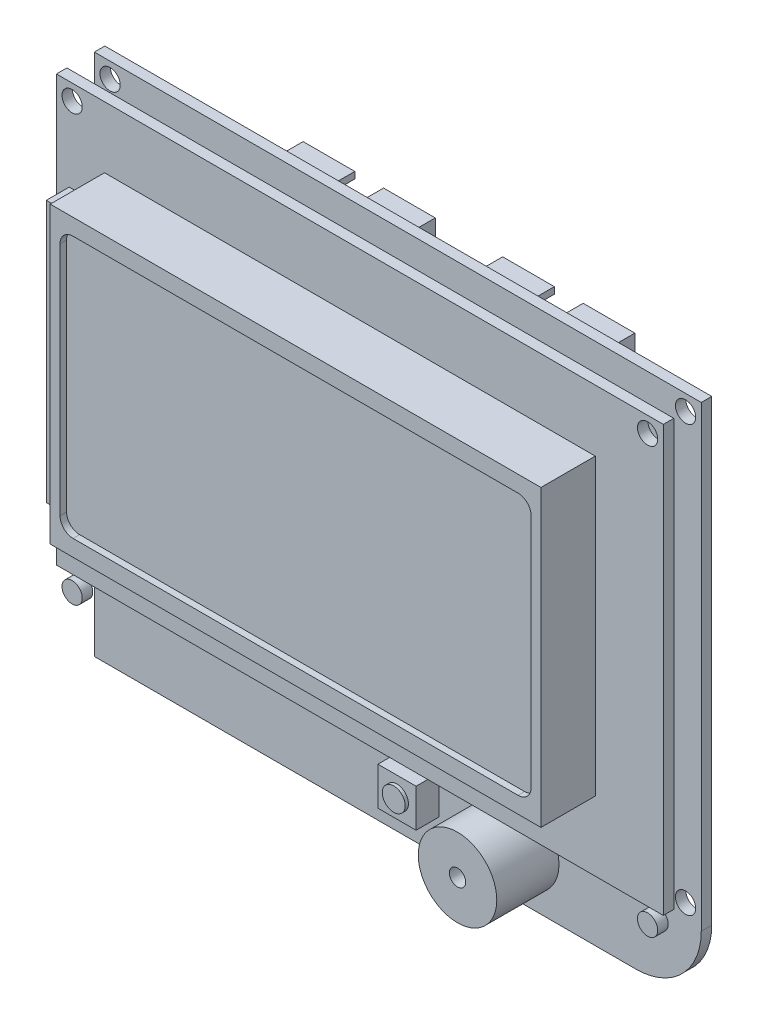
from build123d import *

# Parameters (mm, degrees)
SKETCH1_W                             = 92.75
SKETCH1_H                             = 80
SKETCH1_R                             = 1.55
BOSS_EXTRUDE1_FIRST_PCB_DEPTH         = 1.6
SKETCH2_R                             = 6
BOSS_EXTRUDE2_SPEAKER_DEPTH           = 9.5
SKETCH15_R                            = 1.25
CUT_EXTRUDE1_SPEAKER_HOLE_DEPTH       = 5
SKETCH4_W                             = 5.83
SKETCH4_H                             = 5.83
BOSS_EXTRUDE4_RESET_SWITCH_DEPTH      = 3.5
SKETCH5_R                             = 1.75
BOSS_EXTRUDE5_RESET_BUTTON_DEPTH      = 0.5
SKETCH19_W                            = 50
SKETCH19_H                            = 2.5
BOSS_EXTRUDE10_CONNECTOR_DEPTH        = 4.2
SKETCH11_R                            = 1.55
SKETCH11_W                            = 92.75
SKETCH11_H                            = 65
BOSS_EXTRUDE11_UPPER_PCB_DEPTH        = 1.6
SKETCH12_W                            = 75
SKETCH12_H                            = 45
BOSS_EXTRUDE12_LCD_DEPTH              = 8.3
SKETCH24_W                            = 5.4
SKETCH24_H                            = 40
BOSS_EXTRUDE13_LCD_BUMPOUT_DEPTH      = 3.5
CUT_EXTRUDE2_SCREEN_RECESS_DEPTH      = 1
SKETCH21_W                            = 20.2
SKETCH21_H                            = 8.85
SKETCH21_W_2                          = 18.2
SKETCH21_H_2                          = 6.85
BOSS_EXTRUDE14_CONNECTORS_DEPTH       = 9
SKETCH22_W                            = 18.2
SKETCH22_H                            = 6.85
BOSS_EXTRUDE15_CONNECTOR_RECESS_DEPTH = 2.55
SKETCH23_W                            = 4.4
SKETCH23_H                            = 1
CUT_EXTRUDE3_CONNECTOR_NOTCH_DEPTH    = 6.45
FILLET1_R                             = 10


with BuildPart() as part:
    # Sketch1 → Boss-Extrude1 - First PCB (new body)
    with BuildSketch(Plane.XY):
        Rectangle(SKETCH1_W, SKETCH1_H)
        with Locations((-43.975, 37.6)):
            Circle(SKETCH1_R, mode=Mode.SUBTRACT)
        with Locations(Location((43.975, 37.6, 0), (0, 0, 180))):
            Circle(SKETCH1_R, mode=Mode.SUBTRACT)
        with Locations((43.975, -27.4)):
            Circle(SKETCH1_R, mode=Mode.SUBTRACT)
        with Locations(Location((-43.975, -27.4, 0), (0, 0, 180))):
            Circle(SKETCH1_R, mode=Mode.SUBTRACT)
    extrude(amount=BOSS_EXTRUDE1_FIRST_PCB_DEPTH)

    # Sketch2 → Boss-Extrude2 - Speaker (add)
    with BuildSketch(Plane.XY.offset(1.6)):
        with Locations(Location((18.625, -32, 0), (0, 0, 180))):
            Circle(SKETCH2_R)
    extrude(amount=BOSS_EXTRUDE2_SPEAKER_DEPTH)

    # Sketch15 → Cut-Extrude1 - Speaker Hole (cut)
    with BuildSketch(Plane.XY.offset(11.1)):
        with Locations((18.625, -32)):
            Circle(SKETCH15_R)
    extrude(amount=-CUT_EXTRUDE1_SPEAKER_HOLE_DEPTH, mode=Mode.SUBTRACT)

    # Sketch4 → Boss-Extrude4 - Reset Switch (add)
    with BuildSketch(Plane(origin=(0, 0, 1.6), x_dir=(-1, 0, 0), z_dir=(0, 0, 1))):
        with Locations((-3.375, 32)):
            Rectangle(SKETCH4_W, SKETCH4_H)
    extrude(amount=BOSS_EXTRUDE4_RESET_SWITCH_DEPTH)

    # Sketch5 → Boss-Extrude5 - Reset Button (add)
    with BuildSketch(Plane(origin=(0, 0, 5.1), x_dir=(-1, 0, 0), z_dir=(0, 0, 1))):
        with Locations(Location((-3.375, 32, 0), (0, 0, 180))):
            Circle(SKETCH5_R)
    extrude(amount=BOSS_EXTRUDE5_RESET_BUTTON_DEPTH)

    # Sketch19 → Boss-Extrude10 - Connector (add)
    with BuildSketch(Plane.XY.offset(1.6)):
        with Locations((-8.375, -20.75)):
            Rectangle(SKETCH19_W, SKETCH19_H)
    extrude(amount=BOSS_EXTRUDE10_CONNECTOR_DEPTH)

    # Sketch11 → Boss-Extrude11 - Upper PCB (add)
    # profile 1 of 3: a face of its own
    with BuildSketch(Plane(origin=(0, -2, 5.8), x_dir=(1, 0, 0), z_dir=(0, 0, -1))):
        with Locations(Location((-43.975, 25.4, 0), (0, 0, 180))):
            Circle(SKETCH11_R)
    # profile 2 of 3: a face of its own
    with BuildSketch(Plane(origin=(0, -2, 5.8), x_dir=(1, 0, 0), z_dir=(0, 0, -1))):
        with Locations(Location((43.975, 25.4, 0), (0, 0, 180))):
            Circle(SKETCH11_R)
    # profile 3 of 3: a face of its own
    with BuildSketch(Plane(origin=(0, -2, 5.8), x_dir=(1, 0, 0), z_dir=(0, 0, -1))):
        with Locations((0, -9.5)):
            Rectangle(SKETCH11_W, SKETCH11_H)
        with Locations((-43.975, -39.6)):
            Circle(SKETCH11_R, mode=Mode.SUBTRACT)
        with Locations(Location((43.975, -39.6, 0), (0, 0, 180))):
            Circle(SKETCH11_R, mode=Mode.SUBTRACT)
    extrude(amount=-BOSS_EXTRUDE11_UPPER_PCB_DEPTH)


with BuildPart() as boss_extrude11_upper_pcb_piece_1:
    # of the separate pieces the step leaves, piece 1, a body of its own (boss_extrude11_upper_pcb_pieces)
    add(part.part.solids().sort_by_distance((46.375, -25, 5.8))[0])

    # Sketch12 → Boss-Extrude12 - LCD (add)
    with BuildSketch(Plane(origin=(0, 0, 7.4), x_dir=(-1, 0, 0), z_dir=(0, 0, 1))):
        with Locations((1.525, -8.1)):
            Rectangle(SKETCH12_W, SKETCH12_H)
    extrude(amount=BOSS_EXTRUDE12_LCD_DEPTH)

    # Sketch24 → Boss-Extrude13 - LCD Bumpout (add)
    with BuildSketch(Plane.XY.offset(7.4)):
        with Locations((-41.725, 6)):
            Rectangle(SKETCH24_W, SKETCH24_H)
    extrude(amount=BOSS_EXTRUDE13_LCD_BUMPOUT_DEPTH)

    # Sketch13 → Cut-Extrude2 - Screen Recess (cut)
    with BuildSketch(Plane(origin=(0, 0, 15.7), x_dir=(-1, 0, 0), z_dir=(0, 0, 1))):
        with BuildLine():
            Line((-32.475, 11.9), (35.525, 11.9))
            ThreePointArc((35.525, 11.9), (36.939213562, 11.314213562), (37.525, 9.9))
            Line((37.525, 9.9), (37.525, -26.1))
            ThreePointArc((37.525, -26.1), (36.939213562, -27.514213562), (35.525, -28.1))
            Line((35.525, -28.1), (-32.475, -28.1))
            ThreePointArc((-32.475, -28.1), (-33.889213562, -27.514213562), (-34.475, -26.1))
            Line((-34.475, -26.1), (-34.475, 9.9))
            ThreePointArc((-34.475, 9.9), (-33.889213562, 11.314213562), (-32.475, 11.9))
        make_face()
    extrude(amount=-CUT_EXTRUDE2_SCREEN_RECESS_DEPTH, mode=Mode.SUBTRACT)

    # Sketch21 → Boss-Extrude14 - Connectors (add)
    # profile 1 of 2: a face of its own
    with BuildSketch(Plane(origin=(0, 0, 0), x_dir=(-1, 0, 0), z_dir=(0, 0, -1))):
        with Locations((-15.525, 29.075)):
            Rectangle(SKETCH21_W, SKETCH21_H)
        with Locations((-15.525, 29.075)):
            Rectangle(SKETCH21_W_2, SKETCH21_H_2, mode=Mode.SUBTRACT)
    # profile 2 of 2: a face of its own
    with BuildSketch(Plane(origin=(0, 0, 0), x_dir=(-1, 0, 0), z_dir=(0, 0, -1))):
        with Locations((14.975, 29.075)):
            Rectangle(SKETCH21_W, SKETCH21_H)
        with Locations((14.975, 29.075)):
            Rectangle(SKETCH21_W_2, SKETCH21_H_2, mode=Mode.SUBTRACT)
    extrude(amount=BOSS_EXTRUDE14_CONNECTORS_DEPTH)

    # Sketch22 → Boss-Extrude15 - Connector Recess (add)
    with BuildSketch(Plane(origin=(0, 0, 0), x_dir=(-1, 0, 0), z_dir=(0, 0, -1))):
        with Locations((-15.525, 29.075)):
            Rectangle(SKETCH22_W, SKETCH22_H)
        with Locations((14.975, 29.075)):
            Rectangle(SKETCH22_W, SKETCH22_H)
    extrude(amount=BOSS_EXTRUDE15_CONNECTOR_RECESS_DEPTH)

    # Sketch23 → Cut-Extrude3 - Connector Notch (cut)
    with BuildSketch(Plane(origin=(0, 0, -9), x_dir=(-1, 0, 0), z_dir=(0, 0, -1))):
        with Locations((-15.525, 33)):
            Rectangle(SKETCH23_W, SKETCH23_H)
        with Locations((14.975, 33)):
            Rectangle(SKETCH23_W, SKETCH23_H)
    extrude(amount=-CUT_EXTRUDE3_CONNECTOR_NOTCH_DEPTH, mode=Mode.SUBTRACT)

    # Fillet1
    fillet1_edges = [boss_extrude11_upper_pcb_piece_1.edges().sort_by_distance(p)[0] for p in [
        (46.375, -40, 0.8),
    ]]
    fillet(fillet1_edges, radius=FILLET1_R)


with BuildPart() as boss_extrude11_upper_pcb_piece_2:
    # of the separate pieces the step leaves, piece 2, a body of its own (boss_extrude11_upper_pcb_pieces)
    add(part.part.solids().sort_by_distance((-45.525, -27.4, 5.8))[0])


with BuildPart() as boss_extrude11_upper_pcb_piece_3:
    # of the separate pieces the step leaves, piece 3, a body of its own (boss_extrude11_upper_pcb_pieces)
    add(part.part.solids().sort_by_distance((42.425, -27.4, 5.8))[0])


solid = Compound([boss_extrude11_upper_pcb_piece_1.part, boss_extrude11_upper_pcb_piece_2.part, boss_extrude11_upper_pcb_piece_3.part])
